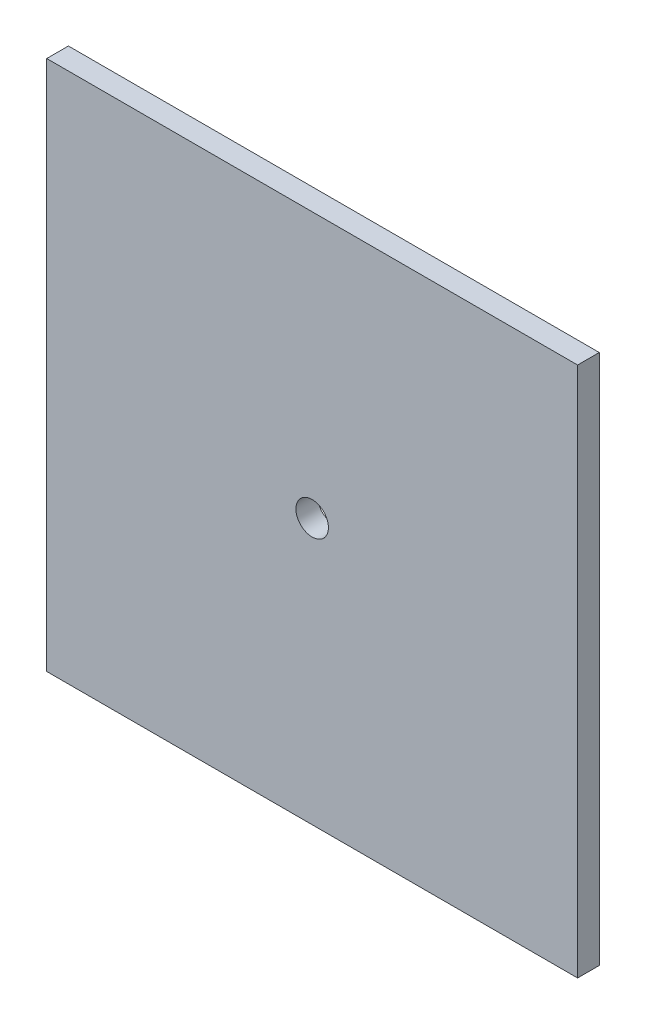
from build123d import *

# Parameters (mm, degrees)
ESQUISSE1_W        = 49
ESQUISSE1_H        = 49
ESQUISSE1_R        = 1.5
BOSS_EXTRU_1_DEPTH = 2


with BuildPart() as part:
    # Esquisse1 → Boss.-Extru.1 (new body)
    with BuildSketch(Plane.XY):
        Rectangle(ESQUISSE1_W, ESQUISSE1_H)
        Circle(ESQUISSE1_R, mode=Mode.SUBTRACT)
    extrude(amount=BOSS_EXTRU_1_DEPTH)


solid = part.part
